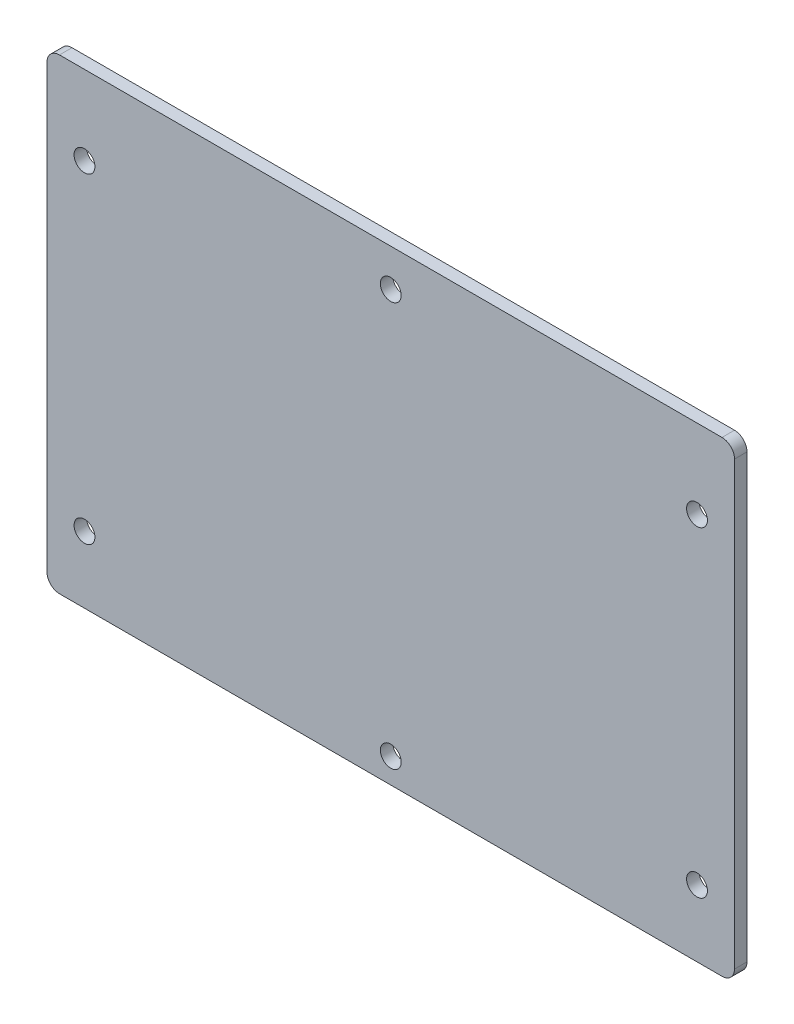
from build123d import *

# Parameters (mm, degrees)
SKETCH_1_W          = 165
SKETCH_1_H          = 118.00212
SKETCH_1_R          = 2.5
EXTRUDE_1_DEPTH     = 3
FILLET_1_R          = 3
CUT_EXTRUDE_START   = -10
CUT_EXTRUDE_1_DEPTH = 10
FILLET_2_R          = 3


with BuildPart() as part:
    # ｽｹｯﾁ1 → ﾎﾞｽ - 押し出し1 (new body)
    with BuildSketch(Plane.XY):
        with Locations((82.5, 59.00106)):
            Rectangle(SKETCH_1_W, SKETCH_1_H)
        with Locations((82.5, 109.00212)):
            Circle(SKETCH_1_R, mode=Mode.SUBTRACT)
        with Locations((9, 99.00212)):
            Circle(SKETCH_1_R, mode=Mode.SUBTRACT)
        with Locations(Location((9, 22, 0), (0, 0, 180))):
            Circle(SKETCH_1_R, mode=Mode.SUBTRACT)
        with Locations(Location((82.5, 12, 0), (0, 0, 180))):
            Circle(SKETCH_1_R, mode=Mode.SUBTRACT)
        with Locations(Location((156, 99.00212, 0), (0, 0, 180))):
            Circle(SKETCH_1_R, mode=Mode.SUBTRACT)
        with Locations((156, 22)):
            Circle(SKETCH_1_R, mode=Mode.SUBTRACT)
    extrude(amount=EXTRUDE_1_DEPTH)

    # ﾌｨﾚｯﾄ1
    fillet_1_edges = [part.edges().sort_by_distance(p)[0] for p in [
        (0, 0, 1.5),
        (0, 118.00212, 1.5),
        (165, 118.00212, 1.5),
        (165, 0, 1.5),
    ]]
    fillet(fillet_1_edges, radius=FILLET_1_R)

    # ｽｹｯﾁ3 → ｶｯﾄ - 押し出し1 (cut)
    with BuildSketch(Plane(origin=(0, 0, 0), x_dir=(-1, 0, 0), z_dir=(0, 0, -1)).offset(CUT_EXTRUDE_START)):
        with BuildLine():
            Line((-162, 0), (-82.5, 0))
            Line((-82.5, 0), (-82.5, 6))
            Line((-82.5, 6), (-165, 6))
            Line((-165, 6), (-165, 3))
            ThreePointArc((-165, 3), (-164.121320344, 0.878679656), (-162, 0))
        make_face()
        with BuildLine():
            Line((-82.5, 6), (-82.5, 0))
            Line((-82.5, 0), (-3, 0))
            ThreePointArc((-3, 0), (-0.878679656, 0.878679656), (0, 3))
            Line((0, 3), (0, 6))
            Line((0, 6), (-82.5, 6))
        make_face()
    extrude(amount=CUT_EXTRUDE_1_DEPTH, mode=Mode.SUBTRACT)

    # ﾌｨﾚｯﾄ2
    fillet_2_edges = [part.edges().sort_by_distance(p)[0] for p in [
        (165, 6, 1.5),
        (0, 6, 1.5),
    ]]
    fillet(fillet_2_edges, radius=FILLET_2_R)


solid = part.part
